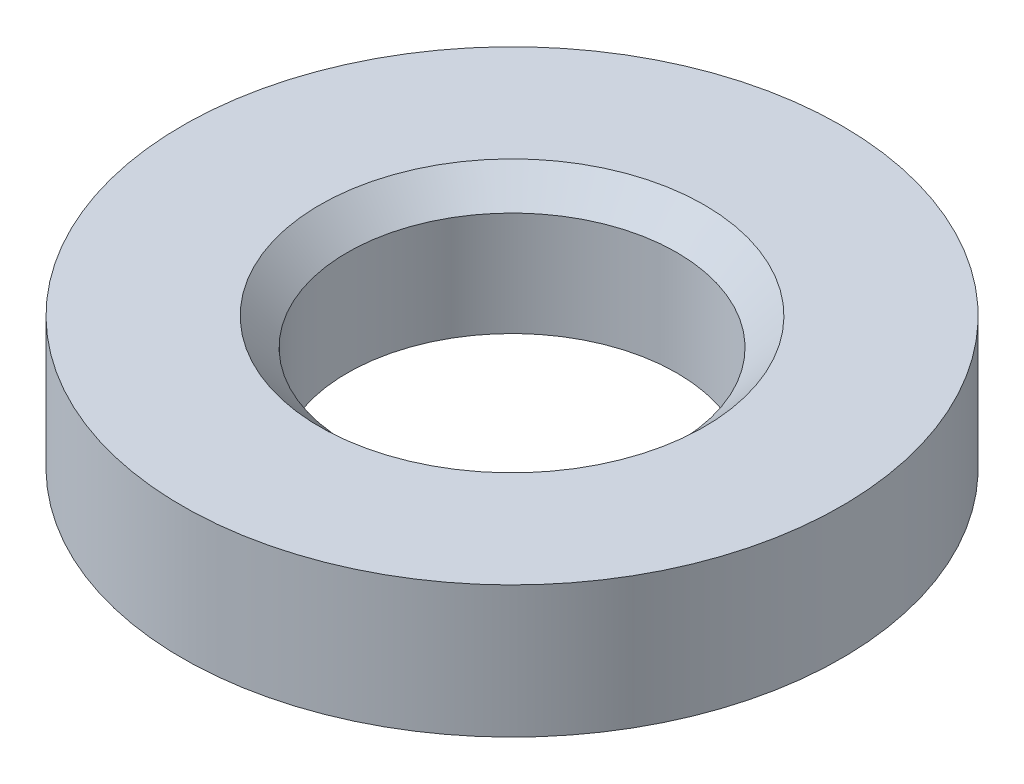
from build123d import *


with BuildPart() as part:
    # Эскиз1 → Повернуть1 (revolve)
    with BuildSketch(Plane.XY, mode=Mode.PRIVATE) as revolve_1_sk:
        Polygon((30, 12), (17.5, 12), (15, 9.5), (15, 0), (30, 0), align=None)
    revolve(revolve_1_sk.sketch.rotate(Axis((0, 12, 0), (0, -1, 0)), 270), axis=Axis((0, 12, 0), (0, -1, 0)))


solid = part.part
